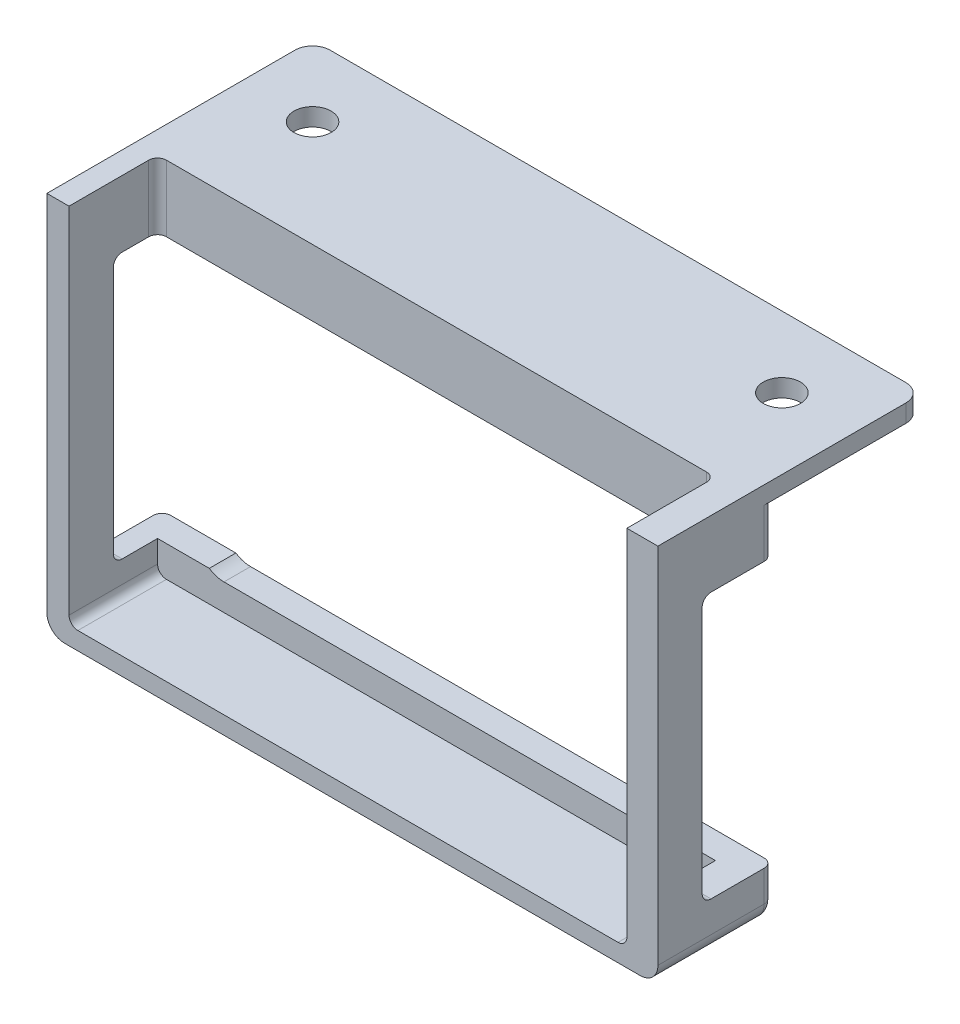
from build123d import *

# Parameters (mm, degrees)
SKETCH_1_W          = 69
SKETCH_1_H          = 30
EXTRUDE_1_DEPTH     = 43
SKETCH_3_W          = 63
SKETCH_3_H          = 10
CUT_EXTRUDE_2_DEPTH = 41
SKETCH_4_W          = 69
SKETCH_4_H          = 17
CUT_EXTRUDE_3_DEPTH = 41
SKETCH_5_R          = 2.1
CUT_EXTRUDE_4_DEPTH = 56.643957444
SKETCH_9_W          = 55
SKETCH_9_H          = 30
CUT_EXTRUDE_5_DEPTH = 58.690987164
FILLET_1_R          = 3
FILLET_2_R          = 2
FILLET_3_R          = 1
SKETCH_10_W         = 8
SKETCH_10_H         = 30
CUT_EXTRUDE_6_DEPTH = 83.674058809
FILLET_4_R          = 1
FILLET_5_R          = 1


with BuildPart() as part:
    # 草图1 → 凸台-拉伸1 (new body)
    with BuildSketch(Plane(origin=(0, 0, 0), x_dir=(1, 0, 0), z_dir=(0, 1, 0))):
        Rectangle(SKETCH_1_W, SKETCH_1_H)
    extrude(amount=EXTRUDE_1_DEPTH)

    # 草图3 → 切除-拉伸2 (cut)
    with BuildSketch(Plane(origin=(0, 43, 0), x_dir=(1, 0, 0), z_dir=(0, 1, 0))):
        with Locations((-0.5, -10)):
            Rectangle(SKETCH_3_W, SKETCH_3_H)
    extrude(amount=-CUT_EXTRUDE_2_DEPTH, mode=Mode.SUBTRACT)

    # 草图4 → 切除-拉伸3 (cut)
    with BuildSketch(Plane(origin=(0, 0, 0), x_dir=(-1, 0, 0), z_dir=(0, -1, 0))):
        with Locations((0, 6.5)):
            Rectangle(SKETCH_4_W, SKETCH_4_H)
    extrude(amount=-CUT_EXTRUDE_3_DEPTH, mode=Mode.SUBTRACT)

    # 草图5 → 切除-拉伸4 (cut, through all)
    with BuildSketch(Plane(origin=(0, 41, 0), x_dir=(-1, 0, 0), z_dir=(0, -1, 0))):
        with Locations(Location((26.5, 7, 0), (0, 0, 90))):
            Circle(SKETCH_5_R)
    cut_extrude_4 = extrude(amount=-CUT_EXTRUDE_4_DEPTH, mode=Mode.SUBTRACT)

    # 镜向1: 切除-拉伸4 across plane
    add(cut_extrude_4.mirror(Plane.ZY), mode=Mode.SUBTRACT)

    # 草图9 → 切除-拉伸5 (cut, through all)
    with BuildSketch(Plane(origin=(0, 0, 2), x_dir=(-1, 0, 0), z_dir=(0, 0, -1))):
        with Locations((0, 20)):
            Rectangle(SKETCH_9_W, SKETCH_9_H)
    extrude(amount=-CUT_EXTRUDE_5_DEPTH, mode=Mode.SUBTRACT)

    # 圆角1
    fillet_1_edges = [part.edges().sort_by_distance(p)[0] for p in [
        (-27.5, 35, 3.5),
        (-27.5, 5, 3.5),
        (27.5, 5, 3.5),
        (27.5, 35, 3.5),
    ]]
    fillet(fillet_1_edges, radius=FILLET_1_R)

    # 圆角2
    fillet_2_edges = [part.edges().sort_by_distance(p)[0] for p in [
        (-34.5, 0, 8.5),
        (34.5, 0, 8.5),
        (-34.5, 42, -15),
        (34.5, 42, -15),
    ]]
    fillet(fillet_2_edges, radius=FILLET_2_R)

    # 圆角3
    fillet_3_edges = [part.edges().sort_by_distance(p)[0] for p in [
        (-32, 2, 10),
        (31, 2, 10),
    ]]
    fillet(fillet_3_edges, radius=FILLET_3_R)

    # 草图10 → 切除-拉伸6 (cut, through all)
    with BuildSketch(Plane.ZY.offset(34.5)):
        with Locations((6, 20.5)):
            Rectangle(SKETCH_10_W, SKETCH_10_H)
    extrude(amount=-CUT_EXTRUDE_6_DEPTH, mode=Mode.SUBTRACT)

    # 圆角4
    fillet_4_edges = [part.edges().sort_by_distance(p)[0] for p in [
        (31, 39.25, 5),
        (-32, 39.25, 5),
        (-33.25, 35.5, 10),
        (32.75, 35.5, 10),
        (32.75, 5.5, 10),
        (-33.25, 5.5, 10),
    ]]
    fillet(fillet_4_edges, radius=FILLET_4_R)

    # 圆角5
    fillet_5_edges = [part.edges().sort_by_distance(p)[0] for p in [
        (0, 0, 2),
        (33.914213562, 0.585786438, 2),
        (-33.914213562, 0.585786438, 2),
        (-34.5, 3.75, 2),
        (34.5, 3.75, 2),
        (-34.5, 38.25, 2),
        (34.5, 38.25, 2),
    ]]
    fillet(fillet_5_edges, radius=FILLET_5_R)


solid = part.part
